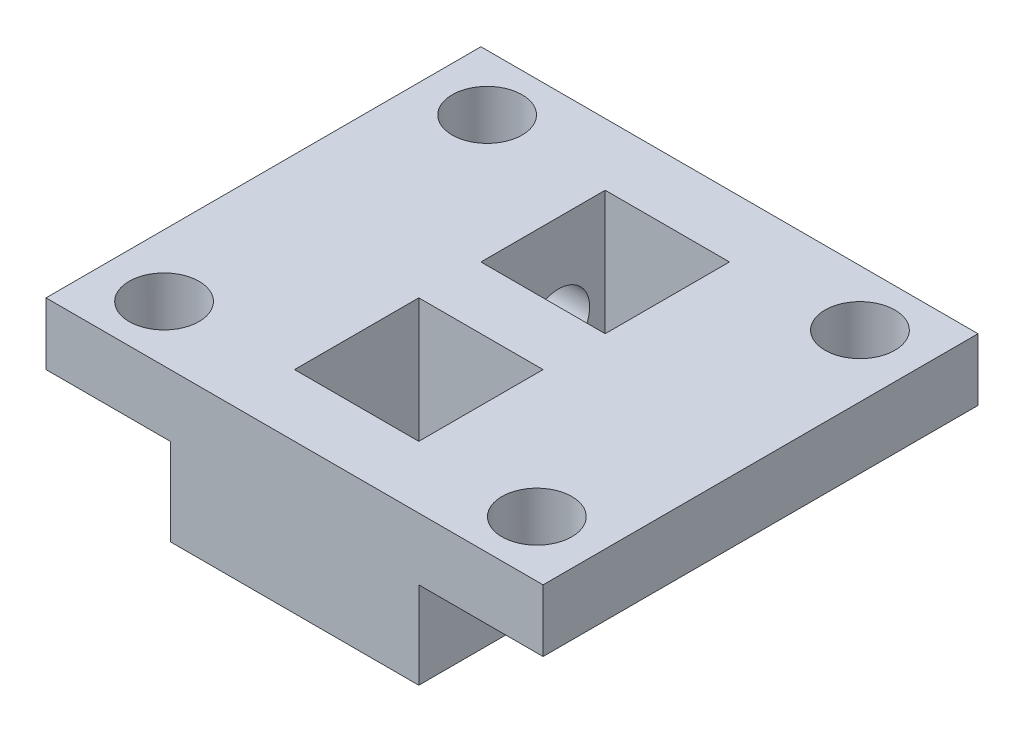
from build123d import *

# Parameters (mm, degrees)
BOSS_EXTRUDE1_DEPTH = 11.1125
SKETCH3_W           = 6.35
SKETCH3_H           = 6.35
CUT_EXTRUDE1_DEPTH  = 6.35
SKETCH2_R           = 1.5875
CUT_EXTRUDE2_DEPTH  = 3.175
CUT_EXTRUDE3_REACH  = 19.451
SKETCH4_R           = 1.7859375


with BuildPart() as part:
    # Sketch1 → Boss-Extrude1 (new body)
    with BuildSketch(Plane.XY):
        Polygon((0, 0), (0, 7.62), (12.7, 7.62), (12.7, 4.445), (6.35, 4.445), (6.35, 0), align=None)
    extrude(amount=BOSS_EXTRUDE1_DEPTH)

    # Mirror1: part across plane


with BuildPart() as part_1:
    add(part.part)
    add(part.part.mirror(Plane(origin=(0, 0, 11.1125), x_dir=(0, 0, 1), z_dir=(-1, 0, 0))))

    # Sketch3 → Cut-Extrude1 (cut)
    with BuildSketch(Plane(origin=(0, 7.62, 0), x_dir=(1, 0, 0), z_dir=(0, 1, 0))):
        with Locations((0, -6.35)):
            Rectangle(SKETCH3_W, SKETCH3_H)
    extrude(amount=-CUT_EXTRUDE1_DEPTH, mode=Mode.SUBTRACT)

    # Sketch2 → Cut-Extrude2 (cut)
    with BuildSketch(Plane.ZY.offset(6.35)):
        with Locations(Location((5.55625, 2.8575, 0), (0, 0, 270))):
            Circle(SKETCH2_R)
    extrude(amount=-CUT_EXTRUDE2_DEPTH, mode=Mode.SUBTRACT)

    # Sketch4 → Cut-Extrude3 (cut, up to next)
    with BuildSketch(Plane.XZ.offset(-4.445), mode=Mode.PRIVATE) as cut_extrude3_sk1:
        with Locations((9.525, 2.8575)):
            Circle(SKETCH4_R)
    cut_extrude3_tool1 = extrude(cut_extrude3_sk1.sketch, amount=-CUT_EXTRUDE3_REACH, mode=Mode.PRIVATE) & part_1.part
    # Sketch4 → Cut-Extrude3 (cut, up to next)
    with BuildSketch(Plane.XZ.offset(-4.445), mode=Mode.PRIVATE) as cut_extrude3_sk2:
        with Locations((-9.525, 2.8575)):
            Circle(SKETCH4_R)
    cut_extrude3_tool2 = extrude(cut_extrude3_sk2.sketch, amount=-CUT_EXTRUDE3_REACH, mode=Mode.PRIVATE) & part_1.part
    add(cut_extrude3_tool1.solids().sort_by_distance((9.525, 4.445, 2.8575))[0], mode=Mode.SUBTRACT)
    add(cut_extrude3_tool2.solids().sort_by_distance((-9.525, 4.445, 2.8575))[0], mode=Mode.SUBTRACT)

    # Mirror2: part across plane


with BuildPart() as part_2:
    add(part_1.part)
    add(part_1.part.mirror(Plane(origin=(0, 0, 11.1125), x_dir=(1, 0, 0), z_dir=(0, 0, -1))))


solid = part_2.part
